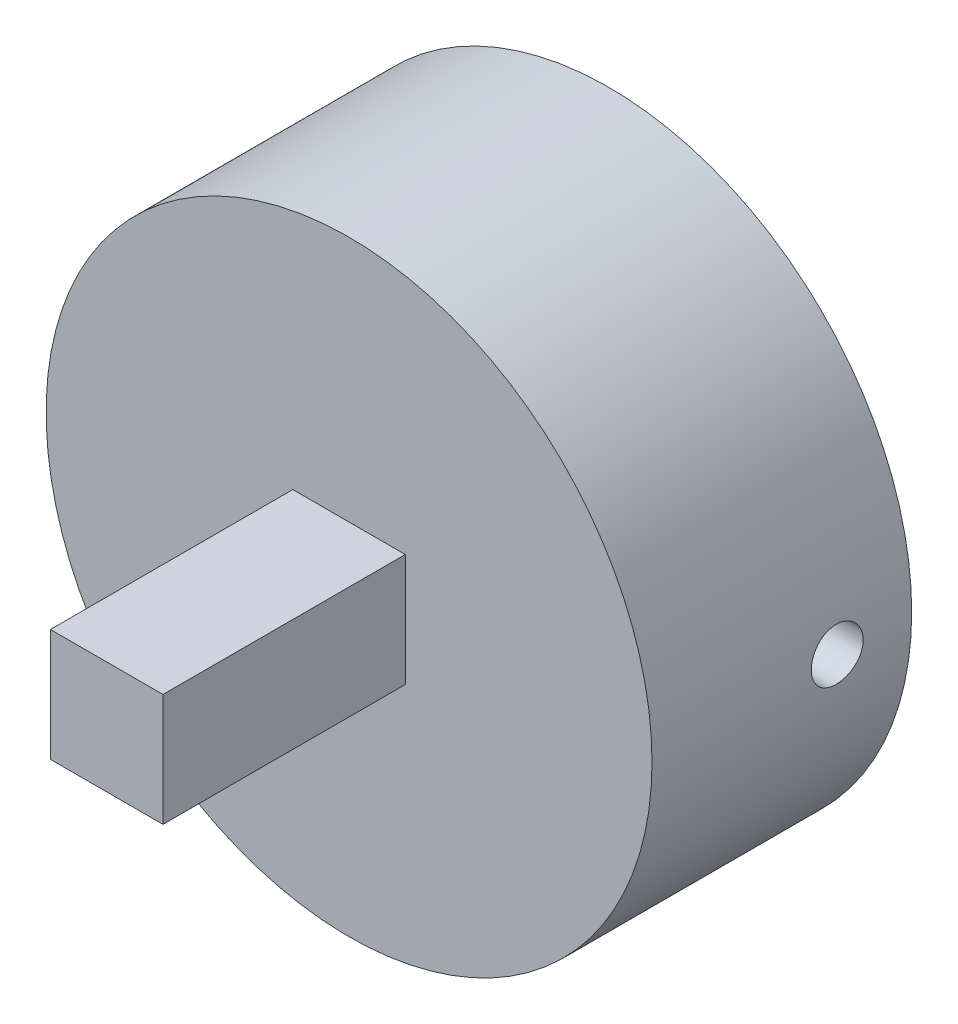
from build123d import *

# Parameters (mm, degrees)
SKETCH1_R                      = 17.5
SKETCH1_R_2                    = 2.5
BOSS_EXTRUDE1_DEPTH            = 10
BOSS_EXTRUDE2_START            = 5
SKETCH1_3_R                    = 17.5
BOSS_EXTRUDE2_DEPTH            = 5
CUT_EXTRUDE1_REACH             = 32.582
SKETCH8_R                      = 1.5
CUT_EXTRUDE1_DIRECTION_2_REACH = 32.582
CUT_EXTRUDE2_DEPTH             = 2.2
SKETCH10_W                     = 6.5
SKETCH10_H                     = 6.5
BOSS_EXTRUDE3_DEPTH            = 14


with BuildPart() as part:
    # Sketch1 → Boss-Extrude1 (new body)
    with BuildSketch(Plane.XY):
        Circle(SKETCH1_R)
        Circle(SKETCH1_R_2, mode=Mode.SUBTRACT)
    extrude(amount=-BOSS_EXTRUDE1_DEPTH)

    # Sketch1<3> → Boss-Extrude2 (add)
    with BuildSketch(Plane.XY.offset(BOSS_EXTRUDE2_START)):
        Circle(SKETCH1_3_R)
    extrude(amount=-BOSS_EXTRUDE2_DEPTH)

    # Sketch8 → Cut-Extrude1 (cut, up to next)
    with BuildSketch(Plane(origin=(5.5, 0, 0), x_dir=(0, 0, -1), z_dir=(1, 0, 0)), mode=Mode.PRIVATE) as cut_extrude1_sk1:
        with Locations((5.7, 0)):
            Circle(SKETCH8_R)
    cut_extrude1_tool1 = extrude(cut_extrude1_sk1.sketch, amount=CUT_EXTRUDE1_REACH, mode=Mode.PRIVATE) & part.part
    cut_extrude1 = cut_extrude1_tool1.solids().sort_by_distance((5.5, 0, -5.7))[0]
    add(cut_extrude1, mode=Mode.SUBTRACT)

    # Sketch8 → Cut-Extrude1 direction 2 (cut, up to next)
    with BuildSketch(Plane(origin=(5.5, 0, 0), x_dir=(0, 0, -1), z_dir=(1, 0, 0)), mode=Mode.PRIVATE) as cut_extrude1_direction_2_sk1:
        with Locations((5.7, 0)):
            Circle(SKETCH8_R)
    cut_extrude1_direction_2_tool1 = extrude(cut_extrude1_direction_2_sk1.sketch, amount=-CUT_EXTRUDE1_DIRECTION_2_REACH, mode=Mode.PRIVATE) & part.part
    cut_extrude1_direction_2 = cut_extrude1_direction_2_tool1.solids().sort_by_distance((5.5, 0, -5.7))[0]
    add(cut_extrude1_direction_2, mode=Mode.SUBTRACT)

    # Sketch8<4> → Cut-Extrude2 (cut)
    with BuildSketch(Plane(origin=(5.5, 0, 0), x_dir=(0, 0, -1), z_dir=(1, 0, 0))):
        Polygon((8.5, 2.8), (2.9, 2.8), (2.9, -2.8), (8.5, -2.8), (10, -2.8), (10, 2.8), align=None)
    cut_extrude2 = extrude(amount=CUT_EXTRUDE2_DEPTH, mode=Mode.SUBTRACT)

    # Mirror1: Cut-Extrude1, Cut-Extrude1 direction 2, Cut-Extrude2 across plane
    add(cut_extrude1.mirror(Plane(origin=(0, 0, 0), x_dir=(0, 0, 1), z_dir=(1, 0, 0))), mode=Mode.SUBTRACT)
    add(cut_extrude1_direction_2.mirror(Plane(origin=(0, 0, 0), x_dir=(0, 0, 1), z_dir=(1, 0, 0))), mode=Mode.SUBTRACT)
    add(cut_extrude2.mirror(Plane(origin=(0, 0, 0), x_dir=(0, 0, 1), z_dir=(1, 0, 0))), mode=Mode.SUBTRACT)

    # Sketch10 → Boss-Extrude3 (add)
    with BuildSketch(Plane.XY.offset(5)):
        Rectangle(SKETCH10_W, SKETCH10_H)
    extrude(amount=BOSS_EXTRUDE3_DEPTH)


solid = part.part
